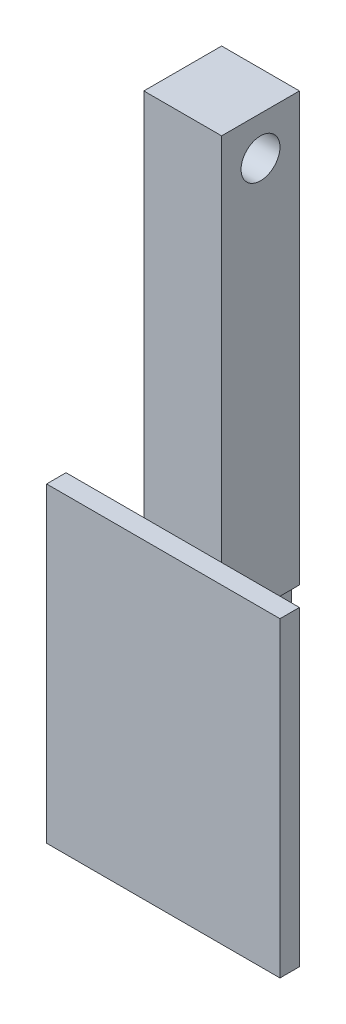
from build123d import *

# Parameters (mm, degrees)
SKETCH1_W           = 25.4
SKETCH1_H           = 25.4
BOSS_EXTRUDE1_DEPTH = 222.25
SKETCH2_W           = 2.54
SKETCH2_H           = 82.55
CUT_EXTRUDE1_DEPTH  = 222.25
SKETCH3_R           = 6.35
SKETCH3_R_2         = 3.175
CUT_EXTRUDE2_DEPTH  = 222.25
SKETCH4_W           = 76.2
SKETCH4_H           = 101.6
BOSS_EXTRUDE3_DEPTH = 6.35


with BuildPart() as part:
    # Sketch1 → Boss-Extrude1 (new body)
    with BuildSketch(Plane(origin=(0, 0, 0), x_dir=(1, 0, 0), z_dir=(0, 1, 0))):
        Rectangle(SKETCH1_W, SKETCH1_H)
    extrude(amount=BOSS_EXTRUDE1_DEPTH)

    # Sketch2 → Cut-Extrude1 (cut)
    with BuildSketch(Plane.XY.offset(12.7)):
        with Locations((-11.43, 41.275)):
            Rectangle(SKETCH2_W, SKETCH2_H)
        with Locations((11.43, 41.275)):
            Rectangle(SKETCH2_W, SKETCH2_H)
    extrude(amount=-CUT_EXTRUDE1_DEPTH, mode=Mode.SUBTRACT)

    # Sketch3 → Cut-Extrude2 (cut)
    with BuildSketch(Plane(origin=(12.7, 0, 0), x_dir=(0, 0, -1), z_dir=(1, 0, 0))):
        with Locations((0, 209.55)):
            Circle(SKETCH3_R)
        with Locations(Location((6.35, 69.85, 0), (0, 0, 90))):
            Circle(SKETCH3_R_2)
        with Locations(Location((6.35, 29.21, 0), (0, 0, 90))):
            Circle(SKETCH3_R_2)
    extrude(amount=-CUT_EXTRUDE2_DEPTH, mode=Mode.SUBTRACT)

    # Sketch4 → Boss-Extrude3 (add)
    with BuildSketch(Plane.XY.offset(12.7)):
        with Locations((0, 50.8)):
            Rectangle(SKETCH4_W, SKETCH4_H)
    extrude(amount=BOSS_EXTRUDE3_DEPTH)


solid = part.part
